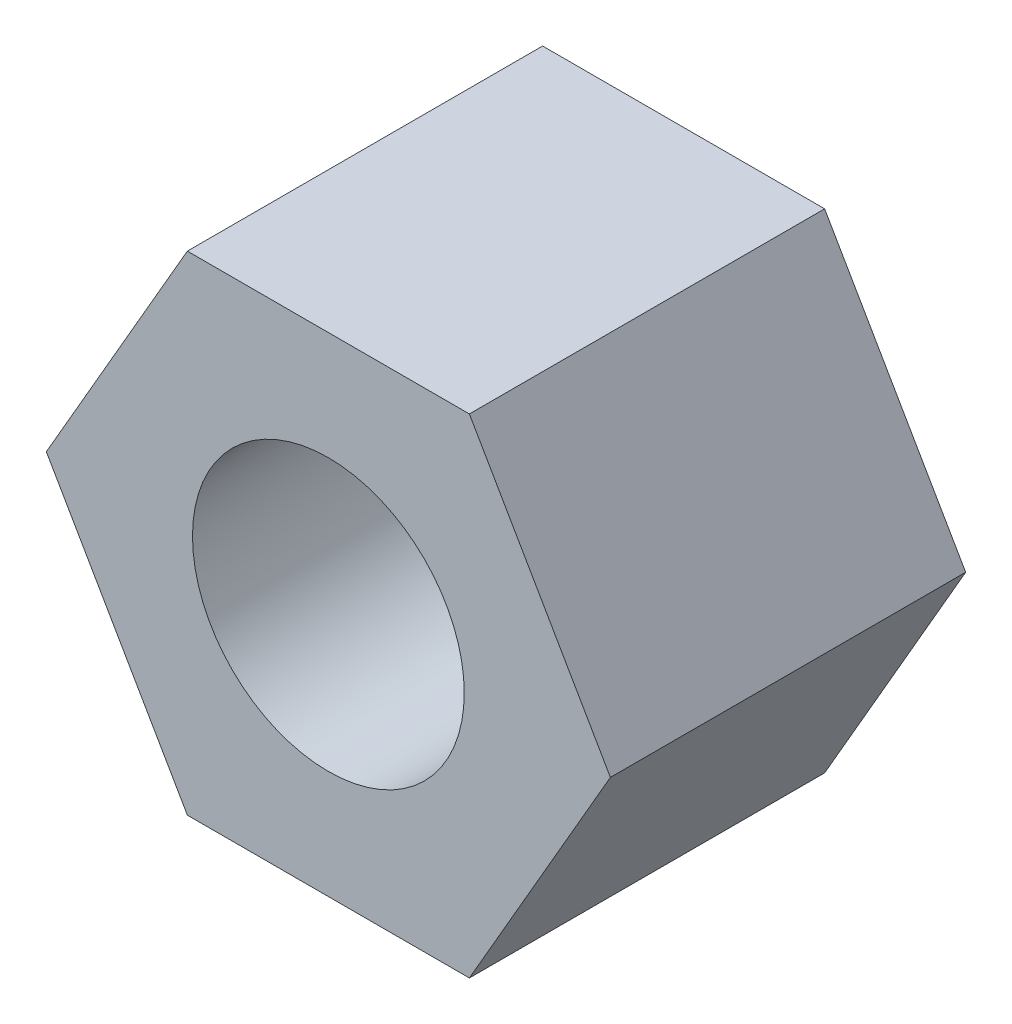
from build123d import *

# Parameters (mm, degrees)
S01_HEXAGON_AND_NOMINAL_THREAD_ENVELOP_R       = 1.53
F_01_HEXAGON_AND_NOMINAL_THREAD_ENVELOPE_DEPTH = 4


with BuildPart() as part:
    # S01 - Hexagon and nominal thread envelope → 01 - Hexagon and nominal thread envelope (new body)
    with BuildSketch(Plane.XY):
        Polygon((3.175426481, 0), (1.58771324, 2.75), (-1.58771324, 2.75), (-3.175426481, 0), (-1.58771324, -2.75), (1.58771324, -2.75), align=None)
        Circle(S01_HEXAGON_AND_NOMINAL_THREAD_ENVELOP_R, mode=Mode.SUBTRACT)
    extrude(amount=F_01_HEXAGON_AND_NOMINAL_THREAD_ENVELOPE_DEPTH)


solid = part.part
